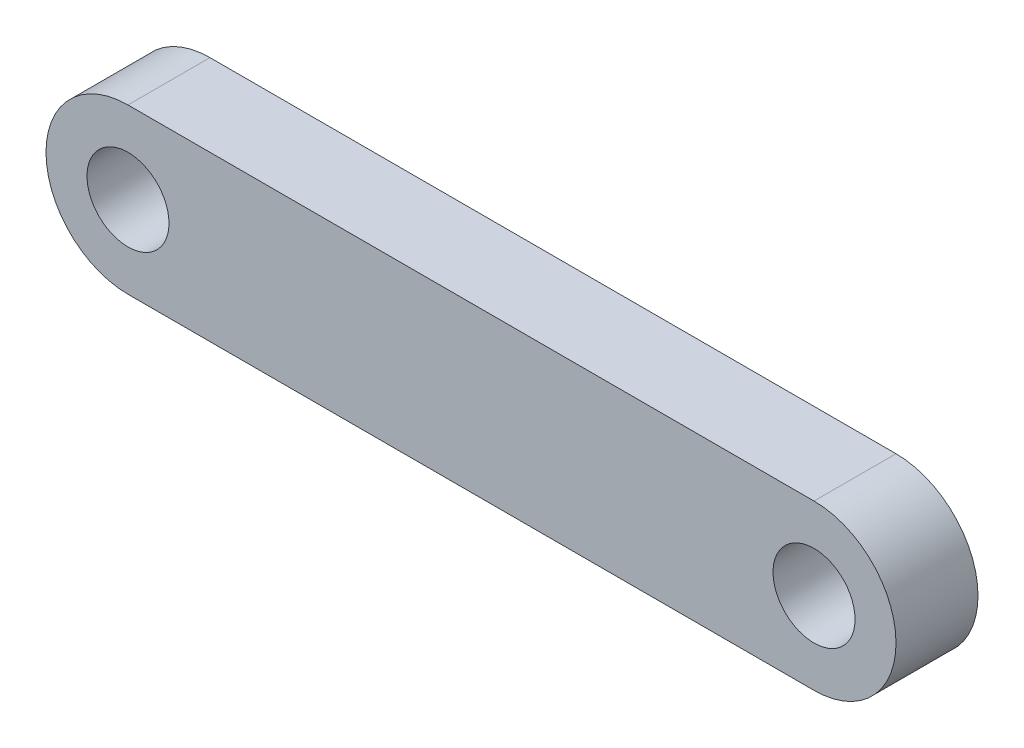
from build123d import *

# Parameters (mm, degrees)
ESBO_O1_R                = 2.5
RESSALTO_EXTRUS_O1_DEPTH = 5


with BuildPart() as part:
    # Esboço1 → Ressalto-extrusão1 (new body)
    with BuildSketch(Plane.XY):
        with BuildLine():
            Line((-20.92, 5), (20.92, 5))
            ThreePointArc((20.92, 5), (25.92, 0), (20.92, -5))
            Line((20.92, -5), (-20.92, -5))
            ThreePointArc((-20.92, -5), (-25.92, 0), (-20.92, 5))
        make_face()
        with Locations((-20.92, 0)):
            Circle(ESBO_O1_R, mode=Mode.SUBTRACT)
        with Locations((20.92, 0)):
            Circle(ESBO_O1_R, mode=Mode.SUBTRACT)
    extrude(amount=RESSALTO_EXTRUS_O1_DEPTH)


solid = part.part
